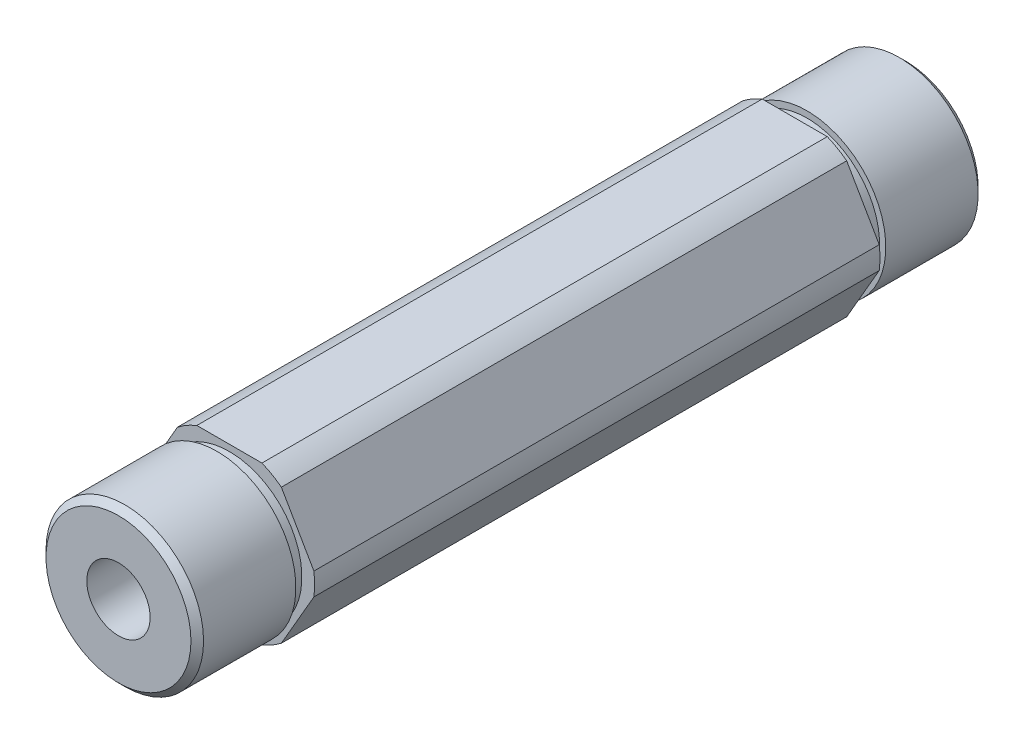
from build123d import *

# Parameters (mm, degrees)
SKETCH2_OUTSIDE_W  = 29.014
SKETCH2_OUTSIDE_H  = 29.014
CUT_EXTRUDE1_DEPTH = 56.367668431
CHAMFER1_SIZE      = 0.508


with BuildPart() as part:
    # Sketch1 → Revolve1 (revolve)
    with BuildSketch(Plane(origin=(0, 0, 0), x_dir=(0, 0, -1), z_dir=(1, 0, 0)), mode=Mode.PRIVATE) as revolve1_sk:
        Polygon((0, 2.5527), (0, 6.35), (7.9502, 6.35), (7.9502, 5.842), (8.9408, 5.842), (8.9408, 6.8707), (19.88570353, 6.8707), (54.5084, 6.8707), (54.5084, 5.842), (55.499, 5.842), (55.499, 6.35), (63.4492, 6.35), (63.4492, 2.5527), (19.88570353, 2.5527), align=None)
    revolve(revolve1_sk.sketch.rotate(Axis((0, 0, 0), (0, 0, 1)), 90), axis=Axis((0, 0, 0), (0, 0, 1)))

    # Sketch2 outside → Cut-Extrude1 (cut, through all)
    with BuildSketch(Plane.XY.offset(-8.9408)):
        Rectangle(SKETCH2_OUTSIDE_W, SKETCH2_OUTSIDE_H)
        Polygon((-3.666174209, 6.35), (-7.332348419, 0), (-3.666174209, -6.35), (3.666174209, -6.35), (7.332348419, 0), (3.666174209, 6.35), align=None, mode=Mode.SUBTRACT)
    extrude(amount=-CUT_EXTRUDE1_DEPTH, mode=Mode.SUBTRACT)

    # Chamfer1
    chamfer1_edges = [part.edges().sort_by_distance(p)[0] for p in [
        (6.35, 0, -63.4492),
        (6.35, 0, 0),
    ]]
    chamfer(chamfer1_edges, length=CHAMFER1_SIZE)


solid = part.part
